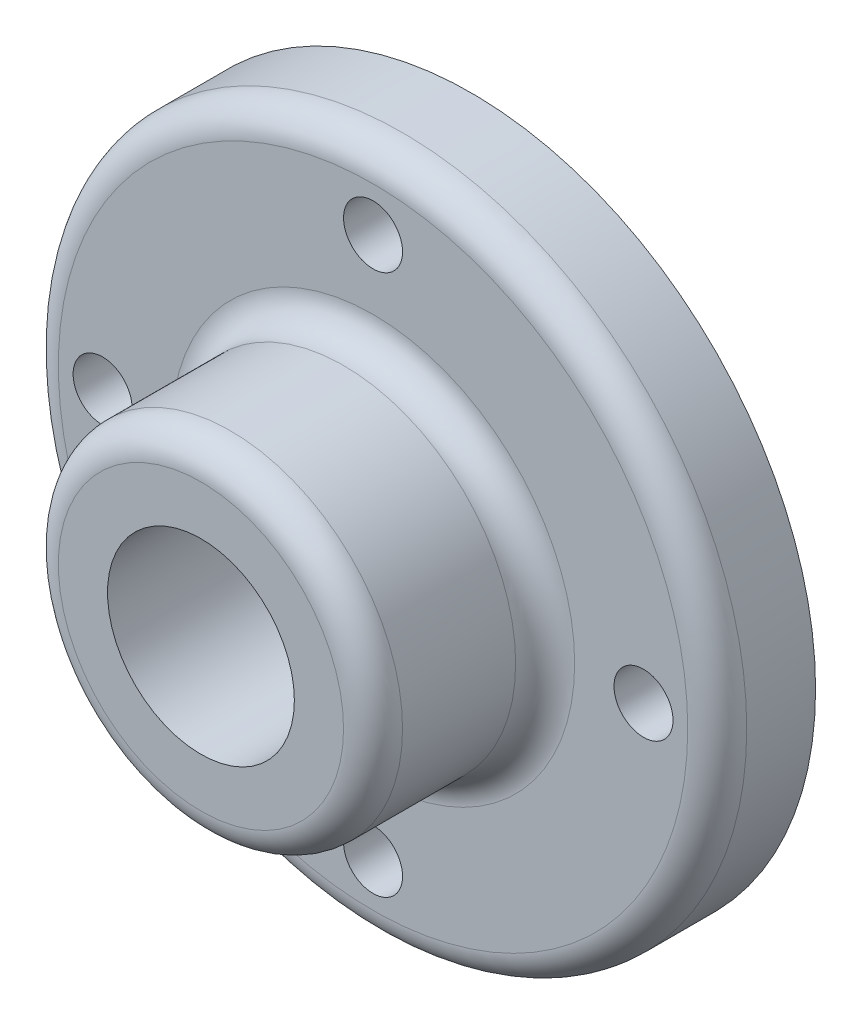
from build123d import *

# Parameters (mm, degrees)
F_12_0_12_DIAMETER_HOLE1_D = 12


with BuildPart() as part:
    # Sketch1 → Revolve1 (revolve)
    with BuildSketch(Plane(origin=(0, 0, 0), x_dir=(1, 0, 0), z_dir=(0, 1, 0))):
        with BuildLine():
            Line((19, 0), (19, 55))
            Line((19, 55), (70, 55))
            Line((70, 55), (70, 41))
            ThreePointArc((70, 41), (68.242640687, 36.757359313), (64, 35))
            Line((64, 35), (41, 35))
            ThreePointArc((41, 35), (36.757359313, 33.242640687), (35, 29))
            Line((35, 29), (35, 6))
            ThreePointArc((35, 6), (33.242640687, 1.757359313), (29, 0))
            Line((29, 0), (19, 0))
        make_face()
    revolve(axis=Axis((0, 0, 0), (0, 0, -1)))

    # Ø12.0 (12) Diameter Hole1 (through all)
    with Locations(Plane.XY.offset(-35)):
        with Locations((0, 55), (55, 0), (0, -55), (-55, 0)):
            Hole(F_12_0_12_DIAMETER_HOLE1_D / 2)


solid = part.part
